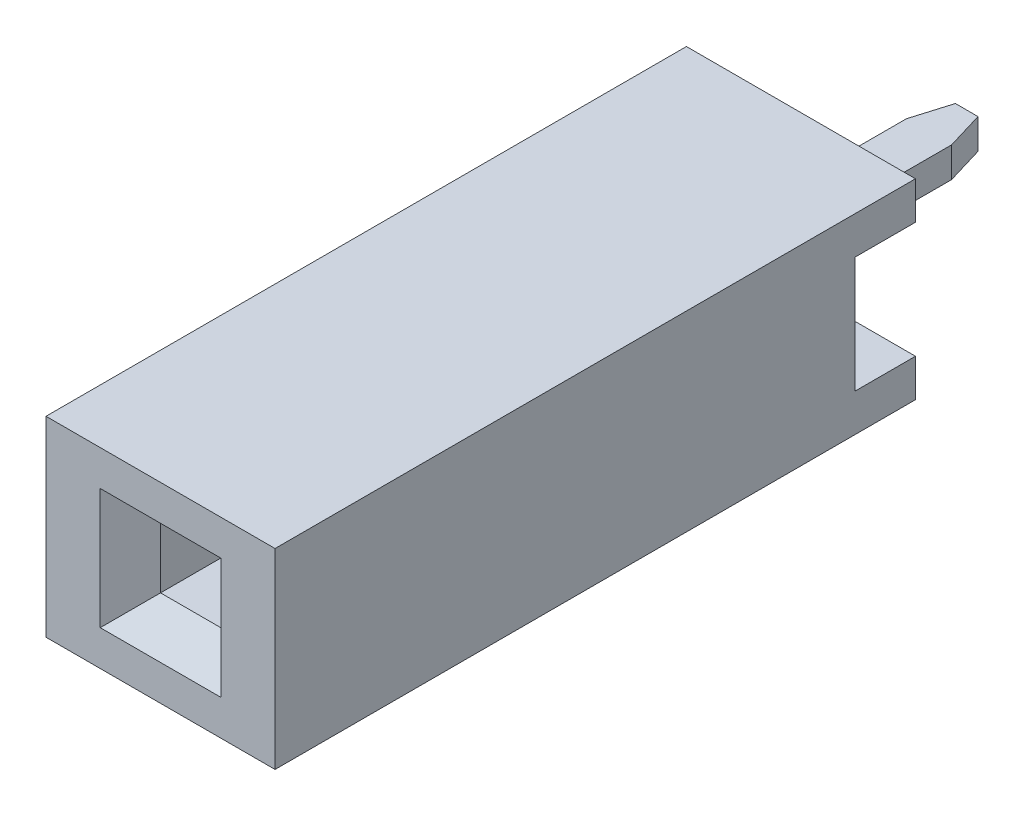
from build123d import *

# Parameters (mm, degrees)
SKETCH1_W           = 2.54
SKETCH1_H           = 8.5
BOSS_EXTRUDE1_DEPTH = 1.52
SKETCH_1_W          = 0.8
SKETCH_1_H          = 1.54
CUT_EXTRUDE_1_DEPTH = 10.116166958
SKETCH2_W           = 0.8
SKETCH2_H           = 0.8
CUT_EXTRUDE1_DEPTH  = 7
CHAMFER_1_SIZE      = 0.4
BOSS_EXTRUDE2_DEPTH = 0.2


with BuildPart() as part:
    # Sketch1 → Boss-Extrude1 (new, symmetric)
    with BuildSketch(Plane(origin=(0, 0, 0), x_dir=(0, -1, 0), z_dir=(1, 0, 0))):
        with Locations((0, -4.25)):
            Rectangle(SKETCH1_W, SKETCH1_H)
    extrude(amount=BOSS_EXTRUDE1_DEPTH, both=True)

    # Эскиз1 → Вырез-Вытянуть1 (cut, through all)
    with BuildSketch(Plane(origin=(1.52, 0, 0), x_dir=(0, 0, -1), z_dir=(1, 0, 0))):
        with Locations((-0.4, 0)):
            Rectangle(SKETCH_1_W, SKETCH_1_H)
    extrude(amount=-CUT_EXTRUDE_1_DEPTH, mode=Mode.SUBTRACT)

    # Sketch2 → Cut-Extrude1 (cut)
    with BuildSketch(Plane(origin=(0, 0, 8.5), x_dir=(-1, 0, 0), z_dir=(0, 0, 1))):
        Rectangle(SKETCH2_W, SKETCH2_H)
    extrude(amount=-CUT_EXTRUDE1_DEPTH, mode=Mode.SUBTRACT)

    # Фаска1
    chamfer_1_edges = [part.edges().sort_by_distance(p)[0] for p in [
        (-0.4, 0, 8.5),
        (0, -0.4, 8.5),
        (0.4, 0, 8.5),
        (0, 0.4, 8.5),
    ]]
    chamfer(chamfer_1_edges, length=CHAMFER_1_SIZE)

    # Sketch3 → Boss-Extrude2 (add, symmetric)
    with BuildSketch(Plane(origin=(0, 0, 0), x_dir=(1, 0, 0), z_dir=(0, 1, 0))):
        Polygon((-0.3, 0), (-0.3, 1.7), (-0.15, 2.2), (0.15, 2.2), (0.3, 1.7), (0.3, 0), (0.3, -0.8), (-0.3, -0.8), align=None)
        Polygon((0.4, -1.5), (-0.4, -1.5), (-0.4, -6.9), (-0.3, -6.9), (-0.3, -1.6), (0.3, -1.6), (0.3, -6.9), (0.4, -6.9), align=None)
    extrude(amount=BOSS_EXTRUDE2_DEPTH, both=True)


solid = part.part
